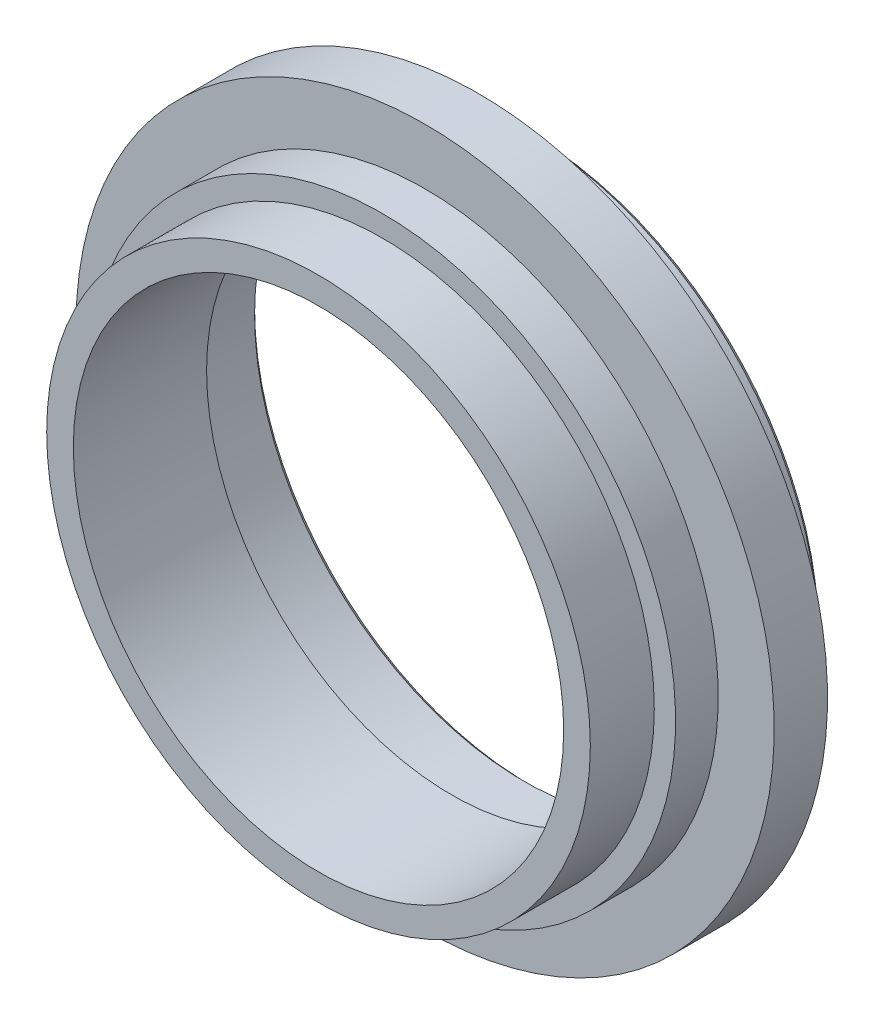
from build123d import *

# Parameters (mm, degrees)
CHAMFER1_SIZE = 0.5


with BuildPart() as part:
    # Sketch1 → Revolve1 (revolve)
    with BuildSketch(Plane(origin=(0, 0, 0), x_dir=(1, 0, 0), z_dir=(0, 1, 0)), mode=Mode.PRIVATE) as revolve1_sk:
        Polygon((25.3, 19.8), (27.6, 19.8), (27.6, 15), (32.75, 15), (32.75, 10), (27.5, 10), (27.5, 6), (25.5, 6), (25.5, 0), (23, 0), (23, 12.5), (25.3, 12.5), align=None)
    revolve(revolve1_sk.sketch.rotate(Axis((0, 0, -99.297916667), (0, 0, 1)), 180), axis=Axis((0, 0, -99.297916667), (0, 0, 1)))

    # Chamfer1
    chamfer1_edges = [part.edges().sort_by_distance(p)[0] for p in [
        (27.6, 0, -19.8),
        (25.3, 0, -19.8),
    ]]
    chamfer(chamfer1_edges, length=CHAMFER1_SIZE)


solid = part.part
